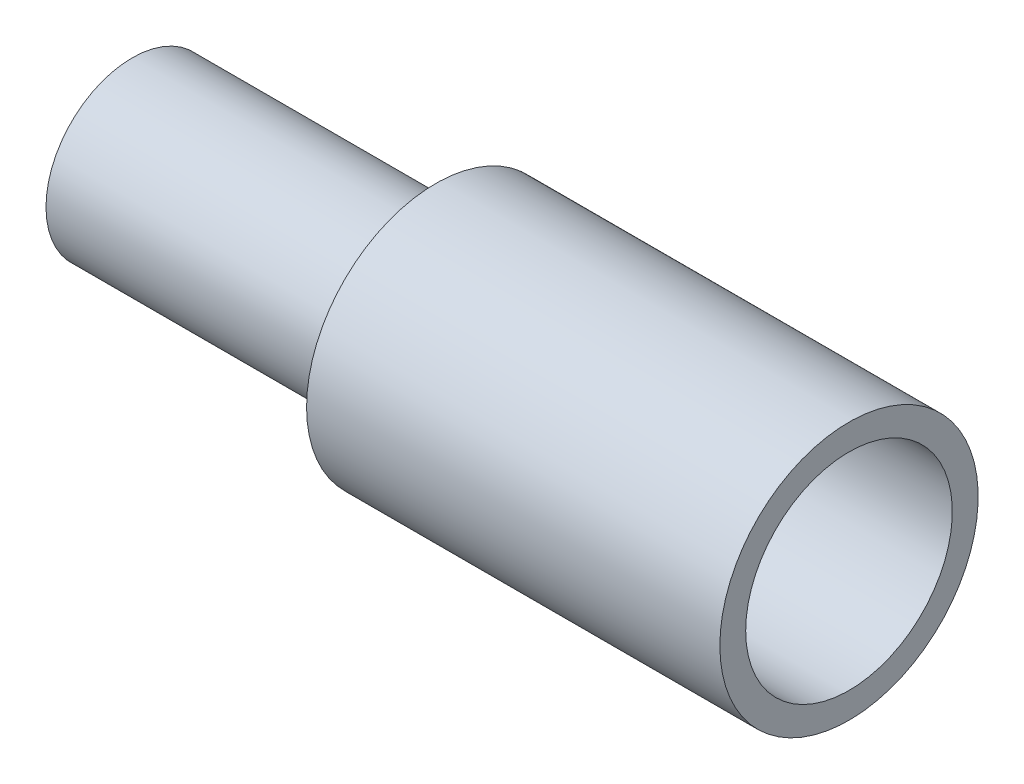
from build123d import *


with BuildPart() as part:
    # Szkic1 → Obrót1 (revolve)
    with BuildSketch(Plane.XY, mode=Mode.PRIVATE) as obr_t1_sk:
        Polygon((27.785447504, 13.35), (-19.214552496, 13.35), (-19.214552496, 9.35), (31.785447504, 9.35), (31.785447504, 16), (91.785447504, 16), (91.785447504, 20), (27.785447504, 20), align=None)
    revolve(obr_t1_sk.sketch.rotate(Axis((-19.214552496, 0, 0), (1, 0, 0)), 90), axis=Axis((-19.214552496, 0, 0), (1, 0, 0)))


solid = part.part
